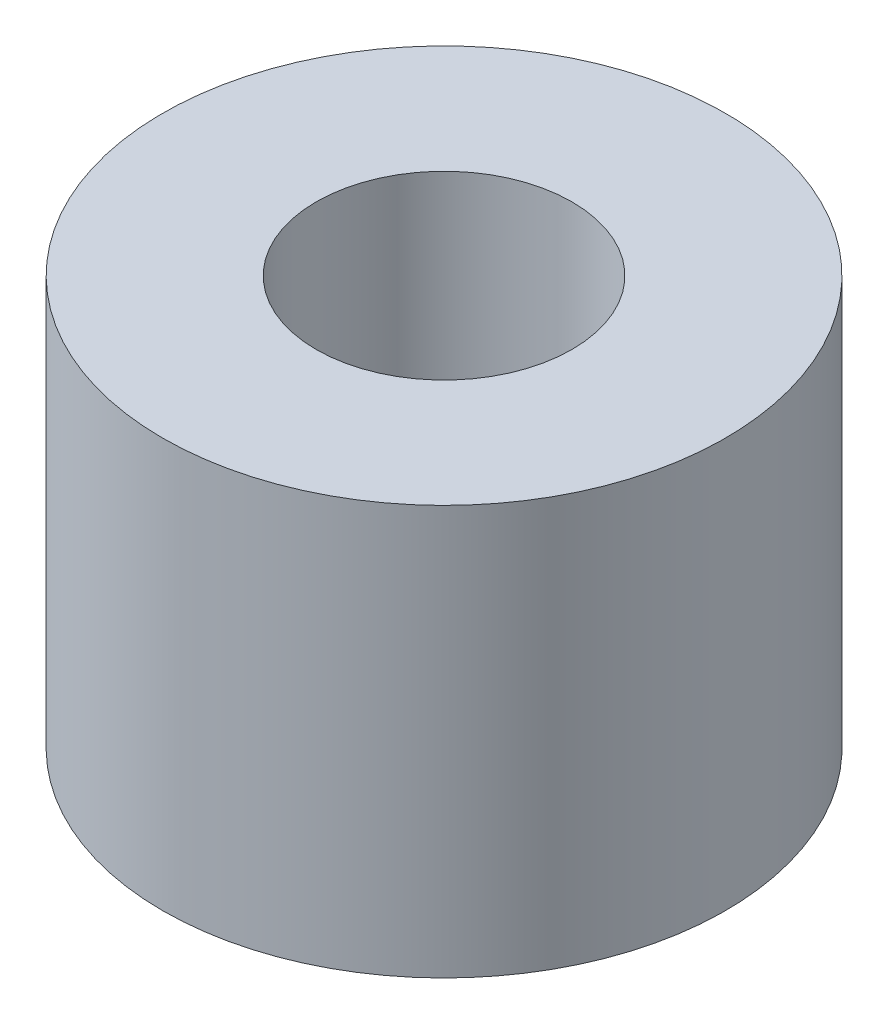
from build123d import *

# Parameters (mm, degrees)
SKETCH_1_R      = 5.5
SKETCH_1_R_2    = 2.5
EXTRUDE_1_DEPTH = 8


with BuildPart() as part:
    # 草图1 → 凸台-拉伸1 (new body)
    with BuildSketch(Plane(origin=(0, 0, 0), x_dir=(1, 0, 0), z_dir=(0, 1, 0))):
        with Locations(Location((0, 0, 0), (0, 0, 270))):
            Circle(SKETCH_1_R)
        with Locations(Location((0, 0, 0), (0, 0, 270))):
            Circle(SKETCH_1_R_2, mode=Mode.SUBTRACT)
    extrude(amount=EXTRUDE_1_DEPTH)


solid = part.part
